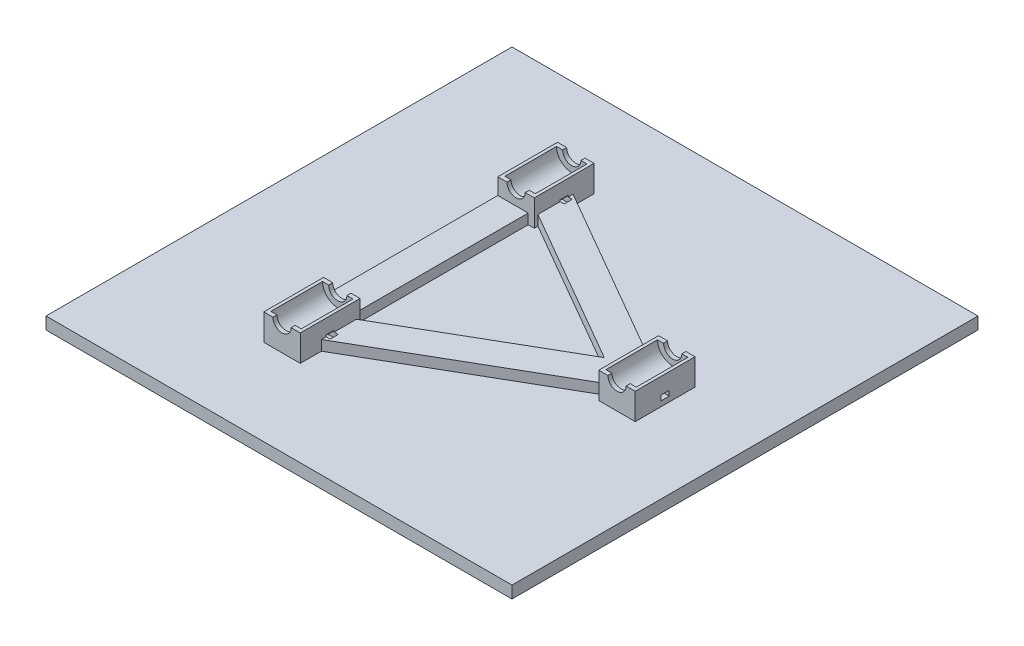
from build123d import *

# Parameters (mm, degrees)
BOTTOM_W                     = 230
BOTTOM_H                     = 230
BOSS_EXTRUDE2_DEPTH          = 6
TRIANGLE_DEPTH               = 5
BOSS_EXTRUDE4_DEPTH          = 8
BOSS_EXTRUDE4_DEPTH_BACK     = 6
SKETCH5_W                    = 18
SKETCH5_H                    = 29.5
ROD_CUTOUT_REACH             = 209.436
SKETCH6_R                    = 4.5
ROD_CUTOUT_DIRECTION_2_REACH = 209.436
LM8SOCKET_START              = -2
SKETCH7_R                    = 7.5
LM8SOCKET_1_DEPTH            = 25.5
LM8SOCKET_START_2            = -27.5
SKETCH8_R                    = 7.5
LM8SOCKET_2_DEPTH            = 25.5
SKETCH9_R                    = 4.5
CUT_EXTRUDE4_DEPTH           = 29.5
CUT_EXTRUDE5_START           = -2
SKETCH11_R                   = 7.5
CUT_EXTRUDE5_DEPTH           = 25.5
SKETCH12_W                   = 4
SKETCH12_H                   = 2.5
CUT_EXTRUDE8_DEPTH           = 20
FILLET1_R                    = 1
FILLET2_R                    = 1
SKETCH13_W                   = 4
SKETCH13_H                   = 2.5
CUT_EXTRUDE9_DEPTH           = 20


with BuildPart() as part:
    # bottom → Boss-Extrude2 (new body)
    with BuildSketch(Plane(origin=(0, 0, 0), x_dir=(1, 0, 0), z_dir=(0, 1, 0))):
        with Locations((-18.058375635, -12.779187817)):
            Rectangle(BOTTOM_W, BOTTOM_H)
    extrude(amount=BOSS_EXTRUDE2_DEPTH)

    # Sketch4 → Triangle (add)
    with BuildSketch(Plane(origin=(0, 6, 0), x_dir=(1, 0, 0), z_dir=(0, 1, 0))):
        Polygon((-68.058375635, 59.720812183), (-68.058375635, -85.279187817), (57.515307914, -12.779187817), align=None)
        Polygon((-53.058375635, -59.298425704), (-53.058375635, 33.740050069), (27.515307914, -12.779187817), align=None, mode=Mode.SUBTRACT)
    extrude(amount=TRIANGLE_DEPTH)

    # Sketch5 → Boss-Extrude4 (add, two sides: drawn at the far end of the back side and taken through both)
    with BuildSketch(Plane(origin=(0, 11, 0), x_dir=(1, 0, 0), z_dir=(0, 1, 0)).offset(-BOSS_EXTRUDE4_DEPTH_BACK)):
        with Locations((-59.058375635, 44.970812183)):
            Rectangle(SKETCH5_W, SKETCH5_H)
        with Locations((-59.058375635, -70.529187817)):
            Rectangle(SKETCH5_W, SKETCH5_H)
        with Locations((48.515307914, -12.779187817)):
            Rectangle(SKETCH5_W, SKETCH5_H)
    extrude(amount=BOSS_EXTRUDE4_DEPTH + BOSS_EXTRUDE4_DEPTH_BACK)

    # Rod cutout: up to this face of the body (flat: up to its plane)
    rod_cutout_end = Plane(part.part.faces().sort_by_distance((-59.058375635, 12.5, -59.720812183))[0])
    # Sketch6 → Rod cutout (cut, up to the picked face)
    with BuildSketch(Plane.XY.offset(-30.220812183), mode=Mode.PRIVATE) as rod_cutout_sk1:
        with Locations((-59.058375635, 19)):
            Circle(SKETCH6_R)
    rod_cutout_tool1 = split(extrude(rod_cutout_sk1.sketch, amount=-ROD_CUTOUT_REACH, mode=Mode.PRIVATE), bisect_by=rod_cutout_end, keep=Keep.BOTH, mode=Mode.PRIVATE)
    add(rod_cutout_tool1.solids().sort_by(Axis((-59.058376, 19, -30.220812), (0, 0, -1)))[0], mode=Mode.SUBTRACT)

    # Rod cutout direction 2: up to this face of the body (flat: up to its plane)
    rod_cutout_direction_2_end = Plane(part.part.faces().sort_by_distance((-59.058375635, 12.5, 85.279187817))[0])
    # Sketch6 → Rod cutout direction 2 (cut, up to the picked face)
    with BuildSketch(Plane.XY.offset(-30.220812183), mode=Mode.PRIVATE) as rod_cutout_direction_2_sk1:
        with Locations((-59.058375635, 19)):
            Circle(SKETCH6_R)
    rod_cutout_direction_2_tool1 = split(extrude(rod_cutout_direction_2_sk1.sketch, amount=ROD_CUTOUT_DIRECTION_2_REACH, mode=Mode.PRIVATE), bisect_by=rod_cutout_direction_2_end, keep=Keep.BOTH, mode=Mode.PRIVATE)
    add(rod_cutout_direction_2_tool1.solids().sort_by(Axis((-59.058376, 19, -30.220812), (0, 0, 1)))[0], mode=Mode.SUBTRACT)

    # Sketch7 → LM8Socket 1 (cut)
    with BuildSketch(Plane.XY.offset(-30.220812183).offset(LM8SOCKET_START)):
        with Locations((-59.058375635, 19)):
            Circle(SKETCH7_R)
    extrude(amount=-LM8SOCKET_1_DEPTH, mode=Mode.SUBTRACT)

    # Sketch8 → LM8Socket 2 (cut)
    with BuildSketch(Plane(origin=(0, 0, 55.779187817), x_dir=(-1, 0, 0), z_dir=(0, 0, -1)).offset(LM8SOCKET_START_2)):
        with Locations((59.058375635, 19)):
            Circle(SKETCH8_R)
    extrude(amount=LM8SOCKET_2_DEPTH, mode=Mode.SUBTRACT)

    # Sketch9 → Cut-Extrude4 (cut)
    with BuildSketch(Plane(origin=(0, 0, -1.970812183), x_dir=(-1, 0, 0), z_dir=(0, 0, -1))):
        with Locations((-48.515307914, 19)):
            Circle(SKETCH9_R)
    extrude(amount=-CUT_EXTRUDE4_DEPTH, mode=Mode.SUBTRACT)

    # Sketch11 → Cut-Extrude5 (cut)
    with BuildSketch(Plane(origin=(0, 0, -1.970812183), x_dir=(-1, 0, 0), z_dir=(0, 0, -1)).offset(CUT_EXTRUDE5_START)):
        with Locations((-48.515307914, 19)):
            Circle(SKETCH11_R)
    extrude(amount=-CUT_EXTRUDE5_DEPTH, mode=Mode.SUBTRACT)

    # Sketch12 → Cut-Extrude8 (cut)
    with BuildSketch(Plane.ZY.offset(68.058375635)):
        with Locations((-44.970812183, 9.75)):
            Rectangle(SKETCH12_W, SKETCH12_H)
        with Locations((70.529187817, 9.75)):
            Rectangle(SKETCH12_W, SKETCH12_H)
    extrude(amount=-CUT_EXTRUDE8_DEPTH, mode=Mode.SUBTRACT)

    # Fillet1
    fillet1_edges = [part.edges().sort_by_distance(p)[0] for p in [
        (-50.058375635, 11, -44.970812183),
    ]]
    fillet(fillet1_edges, radius=FILLET1_R)

    # Fillet2
    fillet2_edges = [part.edges().sort_by_distance(p)[0] for p in [
        (-50.058375635, 11, 70.529187817),
    ]]
    fillet(fillet2_edges, radius=FILLET2_R)

    # Sketch13 → Cut-Extrude9 (cut)
    with BuildSketch(Plane(origin=(57.515307914, 0, 0), x_dir=(0, 0, -1), z_dir=(1, 0, 0))):
        with Locations((-12.779187817, 9.75)):
            Rectangle(SKETCH13_W, SKETCH13_H)
    extrude(amount=-CUT_EXTRUDE9_DEPTH, mode=Mode.SUBTRACT)


solid = part.part
